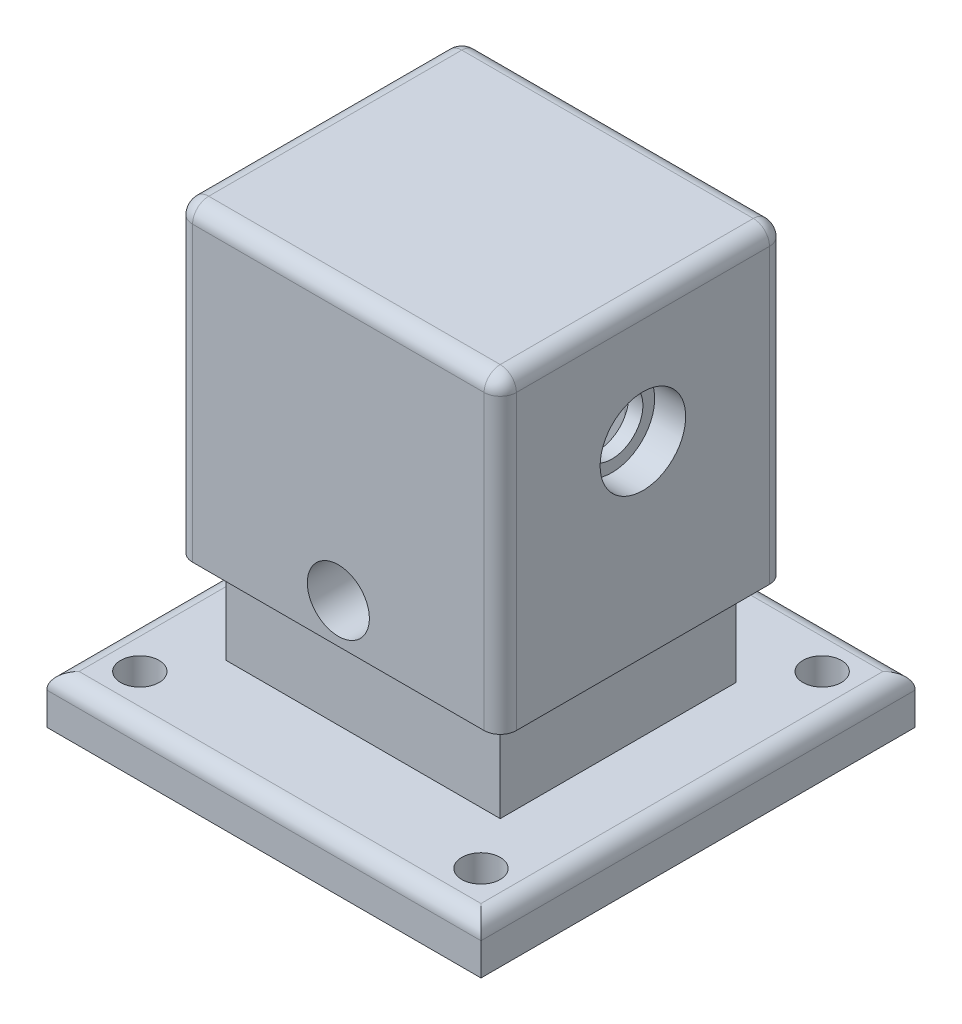
from build123d import *

# Parameters (mm, degrees)
SKETCH1_W                 = 88.9
SKETCH1_H                 = 88.9
SKETCH1_R                 = 3.937
BOSS_EXTRUDE1_DEPTH       = 9.906
SKETCH2_W                 = 56.134
SKETCH2_H                 = 48.26
BOSS_EXTRUDE2_DEPTH       = 19.05
SKETCH3_W                 = 66.294
SKETCH3_H                 = 58.42
BOSS_EXTRUDE3_DEPTH       = 63.246
SKETCH4_W                 = 47.752
SKETCH4_H                 = 25.4
CUT_EXTRUDE1_DEPTH        = 76.2
SKETCH5_W                 = 60.452
SKETCH5_H                 = 38.1
CUT_EXTRUDE2_DEPTH        = 3.302
SKETCH6_R                 = 6.35
CUT_EXTRUDE3_DEPTH        = 129.445730614
SKETCH6_3_R               = 8.763
SKETCH6_3_R_2             = 6.35
CUT_EXTRUDE4_DEPTH        = 6.35
SKETCH8_R                 = 6.35
CUT_EXTRUDE5_DEPTH        = 127.106331736
FILLET1_R                 = 3.302
FILLET2_R                 = 3.302
FILLET3_R                 = 7.112
F_4_40_TAPPED_HOLE2_D     = 2.2606
F_4_40_TAPPED_HOLE2_DEPTH = 8.89
F_4_40_TAPPED_HOLE2_TIP   = 0.679152758


with BuildPart() as part:
    # Sketch1 → Boss-Extrude1 (new body)
    with BuildSketch(Plane(origin=(0, 0, 0), x_dir=(1, 0, 0), z_dir=(0, 1, 0))):
        Rectangle(SKETCH1_W, SKETCH1_H)
        with Locations((-34.925, 34.925)):
            Circle(SKETCH1_R, mode=Mode.SUBTRACT)
        with Locations((-34.925, -34.925)):
            Circle(SKETCH1_R, mode=Mode.SUBTRACT)
        with Locations((34.925, 34.925)):
            Circle(SKETCH1_R, mode=Mode.SUBTRACT)
        with Locations((34.925, -34.925)):
            Circle(SKETCH1_R, mode=Mode.SUBTRACT)
    extrude(amount=BOSS_EXTRUDE1_DEPTH)

    # Sketch2 → Boss-Extrude2 (add)
    with BuildSketch(Plane(origin=(0, 9.906, 0), x_dir=(1, 0, 0), z_dir=(0, 1, 0))):
        Rectangle(SKETCH2_W, SKETCH2_H)
    extrude(amount=BOSS_EXTRUDE2_DEPTH)

    # Sketch3 → Boss-Extrude3 (add)
    with BuildSketch(Plane(origin=(0, 28.956, 0), x_dir=(1, 0, 0), z_dir=(0, 1, 0))):
        Rectangle(SKETCH3_W, SKETCH3_H)
    extrude(amount=BOSS_EXTRUDE3_DEPTH)

    # Sketch4 → Cut-Extrude1 (cut)
    with BuildSketch(Plane.XZ):
        Rectangle(SKETCH4_W, SKETCH4_H)
    extrude(amount=-CUT_EXTRUDE1_DEPTH, mode=Mode.SUBTRACT)

    # Sketch5 → Cut-Extrude2 (cut)
    with BuildSketch(Plane.XZ):
        Rectangle(SKETCH5_W, SKETCH5_H)
    extrude(amount=-CUT_EXTRUDE2_DEPTH, mode=Mode.SUBTRACT)

    # Sketch6 → Cut-Extrude3 (cut, through all)
    with BuildSketch(Plane.ZY.offset(33.147)):
        with Locations((0, 67.31)):
            Circle(SKETCH6_R)
    extrude(amount=-CUT_EXTRUDE3_DEPTH, mode=Mode.SUBTRACT)

    # Sketch6<3> → Cut-Extrude4 (cut)
    with BuildSketch(Plane.ZY.offset(33.147)):
        with Locations((0, 67.31)):
            Circle(SKETCH6_3_R)
        with Locations((0, 67.31)):
            Circle(SKETCH6_3_R_2, mode=Mode.SUBTRACT)
    cut_extrude4 = extrude(amount=-CUT_EXTRUDE4_DEPTH, mode=Mode.SUBTRACT)

    # Mirror1: Cut-Extrude4 across plane
    add(cut_extrude4.mirror(Plane(origin=(0, 0, 0), x_dir=(0, 0, 1), z_dir=(1, 0, 0))), mode=Mode.SUBTRACT)

    # Sketch8 → Cut-Extrude5 (cut, through all)
    with BuildSketch(Plane(origin=(0, 0, -29.21), x_dir=(-1, 0, 0), z_dir=(0, 0, -1))):
        with Locations((0, 37.084)):
            Circle(SKETCH8_R)
    extrude(amount=-CUT_EXTRUDE5_DEPTH, mode=Mode.SUBTRACT)

    # Fillet1
    fillet1_edges = [part.edges().sort_by_distance(p)[0] for p in [
        (0, 92.202, 29.21),
        (-33.147, 92.202, 0),
        (0, 92.202, -29.21),
        (33.147, 92.202, 0),
        (-44.45, 9.906, 0),
        (0, 9.906, 44.45),
        (44.45, 9.906, 0),
        (0, 9.906, -44.45),
        (-33.147, 60.579, -29.21),
        (-33.147, 60.579, 29.21),
        (33.147, 60.579, 29.21),
        (33.147, 60.579, -29.21),
    ]]
    fillet(fillet1_edges, radius=FILLET1_R)

    # Fillet2
    fillet2_edges = [part.edges().sort_by_distance(p)[0] for p in [
        (-30.226, 1.651, -19.05),
        (30.226, 1.651, -19.05),
        (30.226, 1.651, 19.05),
        (-30.226, 1.651, 19.05),
    ]]
    fillet(fillet2_edges, radius=FILLET2_R)

    # Fillet3
    fillet3_edges = [part.edges().sort_by_distance(p)[0] for p in [
        (-23.876, 39.751, -12.7),
        (23.876, 39.751, -12.7),
        (23.876, 39.751, 12.7),
        (-23.876, 39.751, 12.7),
    ]]
    fillet(fillet3_edges, radius=FILLET3_R)

    # #4-40 Tapped Hole2
    with Locations(Plane(origin=(0, 3.302, 0), x_dir=(-1, 0, 0), z_dir=(0, -1, 0))):
        with Locations((26.289, -15.08840493), (-26.289, -15.08840493), (-26.289, 15.08840493), (26.289, 15.08840493)):
            Hole(F_4_40_TAPPED_HOLE2_D / 2, depth=F_4_40_TAPPED_HOLE2_DEPTH)
            with Locations((0, 0, -(F_4_40_TAPPED_HOLE2_DEPTH + F_4_40_TAPPED_HOLE2_TIP / 2))):  # 118° drill point
                Cone(0, F_4_40_TAPPED_HOLE2_D / 2, F_4_40_TAPPED_HOLE2_TIP, mode=Mode.SUBTRACT)


solid = part.part
